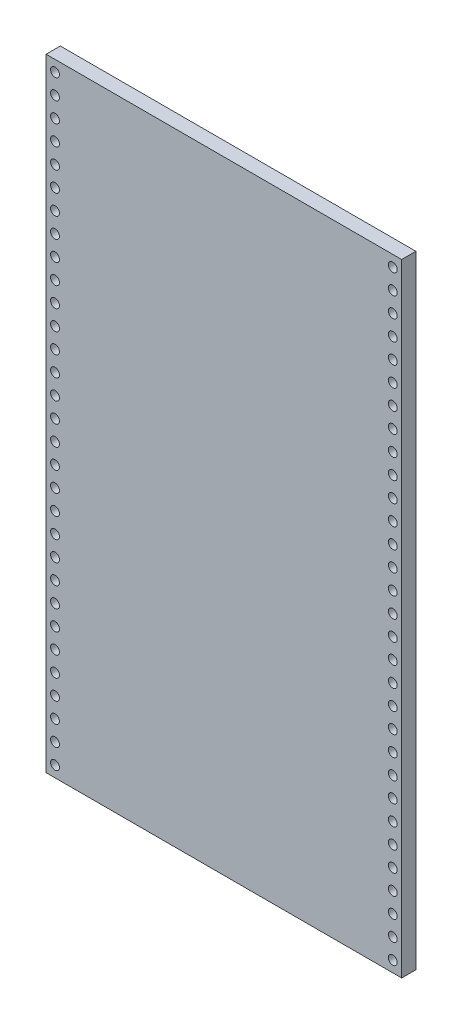
from build123d import *

# Parameters (mm, degrees)
SKETCH1_W                = 400
SKETCH1_H                = 700
BOSS_EXTRUDE1_DEPTH      = 16
SKETCH2_R                = 5
CUT_EXTRUDE1_DEPTH       = 729.186789224
LPATTERN1_COUNT          = 31
LPATTERN1_PITCH          = 22.5
MIRROR1_COPY_1_SKETCH_R  = 5
MIRROR1_COPY_1_DEPTH     = 729.186789224
MIRROR1_COPY_2_SKETCH_R  = 5
MIRROR1_COPY_2_DEPTH     = 729.186789224
MIRROR1_COPY_3_SKETCH_R  = 5
MIRROR1_COPY_3_DEPTH     = 729.186789224
MIRROR1_COPY_4_SKETCH_R  = 5
MIRROR1_COPY_4_DEPTH     = 729.186789224
MIRROR1_COPY_5_SKETCH_R  = 5
MIRROR1_COPY_5_DEPTH     = 729.186789224
MIRROR1_COPY_6_SKETCH_R  = 5
MIRROR1_COPY_6_DEPTH     = 729.186789224
MIRROR1_COPY_7_SKETCH_R  = 5
MIRROR1_COPY_7_DEPTH     = 729.186789224
MIRROR1_COPY_8_SKETCH_R  = 5
MIRROR1_COPY_8_DEPTH     = 729.186789224
MIRROR1_COPY_9_SKETCH_R  = 5
MIRROR1_COPY_9_DEPTH     = 729.186789224
MIRROR1_COPY_10_SKETCH_R = 5
MIRROR1_COPY_10_DEPTH    = 729.186789224
MIRROR1_COPY_11_SKETCH_R = 5
MIRROR1_COPY_11_DEPTH    = 729.186789224
MIRROR1_COPY_12_SKETCH_R = 5
MIRROR1_COPY_12_DEPTH    = 729.186789224
MIRROR1_COPY_13_SKETCH_R = 5
MIRROR1_COPY_13_DEPTH    = 729.186789224
MIRROR1_COPY_14_SKETCH_R = 5
MIRROR1_COPY_14_DEPTH    = 729.186789224
MIRROR1_COPY_15_SKETCH_R = 5
MIRROR1_COPY_15_DEPTH    = 729.186789224
MIRROR1_COPY_16_SKETCH_R = 5
MIRROR1_COPY_16_DEPTH    = 729.186789224
MIRROR1_COPY_17_SKETCH_R = 5
MIRROR1_COPY_17_DEPTH    = 729.186789224
MIRROR1_COPY_18_SKETCH_R = 5
MIRROR1_COPY_18_DEPTH    = 729.186789224
MIRROR1_COPY_19_SKETCH_R = 5
MIRROR1_COPY_19_DEPTH    = 729.186789224
MIRROR1_COPY_20_SKETCH_R = 5
MIRROR1_COPY_20_DEPTH    = 729.186789224
MIRROR1_COPY_21_SKETCH_R = 5
MIRROR1_COPY_21_DEPTH    = 729.186789224
MIRROR1_COPY_22_SKETCH_R = 5
MIRROR1_COPY_22_DEPTH    = 729.186789224
MIRROR1_COPY_23_SKETCH_R = 5
MIRROR1_COPY_23_DEPTH    = 729.186789224
MIRROR1_COPY_24_SKETCH_R = 5
MIRROR1_COPY_24_DEPTH    = 729.186789224
MIRROR1_COPY_25_SKETCH_R = 5
MIRROR1_COPY_25_DEPTH    = 729.186789224
MIRROR1_COPY_26_SKETCH_R = 5
MIRROR1_COPY_26_DEPTH    = 729.186789224
MIRROR1_COPY_27_SKETCH_R = 5
MIRROR1_COPY_27_DEPTH    = 729.186789224
MIRROR1_COPY_28_SKETCH_R = 5
MIRROR1_COPY_28_DEPTH    = 729.186789224
MIRROR1_COPY_29_SKETCH_R = 5
MIRROR1_COPY_29_DEPTH    = 729.186789224
MIRROR1_COPY_30_SKETCH_R = 5
MIRROR1_COPY_30_DEPTH    = 729.186789224


with BuildPart() as part:
    # Sketch1 → Boss-Extrude1 (new body)
    with BuildSketch(Plane.XY):
        with Locations((0, 350)):
            Rectangle(SKETCH1_W, SKETCH1_H)
    extrude(amount=BOSS_EXTRUDE1_DEPTH)

    # Sketch2 → Cut-Extrude1 (cut, symmetric)
    with BuildSketch(Plane.XY.offset(16)):
        with Locations(Location((190, 12.5, 0), (0, 0, 180))):
            Circle(SKETCH2_R)
    cut_extrude1 = extrude(amount=CUT_EXTRUDE1_DEPTH, both=True, mode=Mode.SUBTRACT)

    # LPattern1: Cut-Extrude1 ×31
    with Locations(*[(0, i * LPATTERN1_PITCH, 0) for i in range(1, LPATTERN1_COUNT)]):
        add(cut_extrude1, mode=Mode.SUBTRACT)

    # Mirror1: Cut-Extrude1 across plane
    add(cut_extrude1.mirror(Plane(origin=(0, 0, 0), x_dir=(0, 0, 1), z_dir=(1, 0, 0))), mode=Mode.SUBTRACT)

    # Mirror1 copy 1 sketch → Mirror1 copy 1 (cut, symmetric)
    with BuildSketch(Plane(origin=(0, 22.5, 16), x_dir=(-1, 0, 0), z_dir=(0, 0, 1))):
        with Locations((190, -12.5)):
            Circle(MIRROR1_COPY_1_SKETCH_R)
    extrude(amount=MIRROR1_COPY_1_DEPTH, both=True, mode=Mode.SUBTRACT)

    # Mirror1 copy 2 sketch → Mirror1 copy 2 (cut, symmetric)
    with BuildSketch(Plane(origin=(0, 45, 16), x_dir=(-1, 0, 0), z_dir=(0, 0, 1))):
        with Locations((190, -12.5)):
            Circle(MIRROR1_COPY_2_SKETCH_R)
    extrude(amount=MIRROR1_COPY_2_DEPTH, both=True, mode=Mode.SUBTRACT)

    # Mirror1 copy 3 sketch → Mirror1 copy 3 (cut, symmetric)
    with BuildSketch(Plane(origin=(0, 67.5, 16), x_dir=(-1, 0, 0), z_dir=(0, 0, 1))):
        with Locations((190, -12.5)):
            Circle(MIRROR1_COPY_3_SKETCH_R)
    extrude(amount=MIRROR1_COPY_3_DEPTH, both=True, mode=Mode.SUBTRACT)

    # Mirror1 copy 4 sketch → Mirror1 copy 4 (cut, symmetric)
    with BuildSketch(Plane(origin=(0, 90, 16), x_dir=(-1, 0, 0), z_dir=(0, 0, 1))):
        with Locations((190, -12.5)):
            Circle(MIRROR1_COPY_4_SKETCH_R)
    extrude(amount=MIRROR1_COPY_4_DEPTH, both=True, mode=Mode.SUBTRACT)

    # Mirror1 copy 5 sketch → Mirror1 copy 5 (cut, symmetric)
    with BuildSketch(Plane(origin=(0, 112.5, 16), x_dir=(-1, 0, 0), z_dir=(0, 0, 1))):
        with Locations((190, -12.5)):
            Circle(MIRROR1_COPY_5_SKETCH_R)
    extrude(amount=MIRROR1_COPY_5_DEPTH, both=True, mode=Mode.SUBTRACT)

    # Mirror1 copy 6 sketch → Mirror1 copy 6 (cut, symmetric)
    with BuildSketch(Plane(origin=(0, 135, 16), x_dir=(-1, 0, 0), z_dir=(0, 0, 1))):
        with Locations((190, -12.5)):
            Circle(MIRROR1_COPY_6_SKETCH_R)
    extrude(amount=MIRROR1_COPY_6_DEPTH, both=True, mode=Mode.SUBTRACT)

    # Mirror1 copy 7 sketch → Mirror1 copy 7 (cut, symmetric)
    with BuildSketch(Plane(origin=(0, 157.5, 16), x_dir=(-1, 0, 0), z_dir=(0, 0, 1))):
        with Locations((190, -12.5)):
            Circle(MIRROR1_COPY_7_SKETCH_R)
    extrude(amount=MIRROR1_COPY_7_DEPTH, both=True, mode=Mode.SUBTRACT)

    # Mirror1 copy 8 sketch → Mirror1 copy 8 (cut, symmetric)
    with BuildSketch(Plane(origin=(0, 180, 16), x_dir=(-1, 0, 0), z_dir=(0, 0, 1))):
        with Locations((190, -12.5)):
            Circle(MIRROR1_COPY_8_SKETCH_R)
    extrude(amount=MIRROR1_COPY_8_DEPTH, both=True, mode=Mode.SUBTRACT)

    # Mirror1 copy 9 sketch → Mirror1 copy 9 (cut, symmetric)
    with BuildSketch(Plane(origin=(0, 202.5, 16), x_dir=(-1, 0, 0), z_dir=(0, 0, 1))):
        with Locations((190, -12.5)):
            Circle(MIRROR1_COPY_9_SKETCH_R)
    extrude(amount=MIRROR1_COPY_9_DEPTH, both=True, mode=Mode.SUBTRACT)

    # Mirror1 copy 10 sketch → Mirror1 copy 10 (cut, symmetric)
    with BuildSketch(Plane(origin=(0, 225, 16), x_dir=(-1, 0, 0), z_dir=(0, 0, 1))):
        with Locations((190, -12.5)):
            Circle(MIRROR1_COPY_10_SKETCH_R)
    extrude(amount=MIRROR1_COPY_10_DEPTH, both=True, mode=Mode.SUBTRACT)

    # Mirror1 copy 11 sketch → Mirror1 copy 11 (cut, symmetric)
    with BuildSketch(Plane(origin=(0, 247.5, 16), x_dir=(-1, 0, 0), z_dir=(0, 0, 1))):
        with Locations((190, -12.5)):
            Circle(MIRROR1_COPY_11_SKETCH_R)
    extrude(amount=MIRROR1_COPY_11_DEPTH, both=True, mode=Mode.SUBTRACT)

    # Mirror1 copy 12 sketch → Mirror1 copy 12 (cut, symmetric)
    with BuildSketch(Plane(origin=(0, 270, 16), x_dir=(-1, 0, 0), z_dir=(0, 0, 1))):
        with Locations((190, -12.5)):
            Circle(MIRROR1_COPY_12_SKETCH_R)
    extrude(amount=MIRROR1_COPY_12_DEPTH, both=True, mode=Mode.SUBTRACT)

    # Mirror1 copy 13 sketch → Mirror1 copy 13 (cut, symmetric)
    with BuildSketch(Plane(origin=(0, 292.5, 16), x_dir=(-1, 0, 0), z_dir=(0, 0, 1))):
        with Locations((190, -12.5)):
            Circle(MIRROR1_COPY_13_SKETCH_R)
    extrude(amount=MIRROR1_COPY_13_DEPTH, both=True, mode=Mode.SUBTRACT)

    # Mirror1 copy 14 sketch → Mirror1 copy 14 (cut, symmetric)
    with BuildSketch(Plane(origin=(0, 315, 16), x_dir=(-1, 0, 0), z_dir=(0, 0, 1))):
        with Locations((190, -12.5)):
            Circle(MIRROR1_COPY_14_SKETCH_R)
    extrude(amount=MIRROR1_COPY_14_DEPTH, both=True, mode=Mode.SUBTRACT)

    # Mirror1 copy 15 sketch → Mirror1 copy 15 (cut, symmetric)
    with BuildSketch(Plane(origin=(0, 337.5, 16), x_dir=(-1, 0, 0), z_dir=(0, 0, 1))):
        with Locations((190, -12.5)):
            Circle(MIRROR1_COPY_15_SKETCH_R)
    extrude(amount=MIRROR1_COPY_15_DEPTH, both=True, mode=Mode.SUBTRACT)

    # Mirror1 copy 16 sketch → Mirror1 copy 16 (cut, symmetric)
    with BuildSketch(Plane(origin=(0, 360, 16), x_dir=(-1, 0, 0), z_dir=(0, 0, 1))):
        with Locations((190, -12.5)):
            Circle(MIRROR1_COPY_16_SKETCH_R)
    extrude(amount=MIRROR1_COPY_16_DEPTH, both=True, mode=Mode.SUBTRACT)

    # Mirror1 copy 17 sketch → Mirror1 copy 17 (cut, symmetric)
    with BuildSketch(Plane(origin=(0, 382.5, 16), x_dir=(-1, 0, 0), z_dir=(0, 0, 1))):
        with Locations((190, -12.5)):
            Circle(MIRROR1_COPY_17_SKETCH_R)
    extrude(amount=MIRROR1_COPY_17_DEPTH, both=True, mode=Mode.SUBTRACT)

    # Mirror1 copy 18 sketch → Mirror1 copy 18 (cut, symmetric)
    with BuildSketch(Plane(origin=(0, 405, 16), x_dir=(-1, 0, 0), z_dir=(0, 0, 1))):
        with Locations((190, -12.5)):
            Circle(MIRROR1_COPY_18_SKETCH_R)
    extrude(amount=MIRROR1_COPY_18_DEPTH, both=True, mode=Mode.SUBTRACT)

    # Mirror1 copy 19 sketch → Mirror1 copy 19 (cut, symmetric)
    with BuildSketch(Plane(origin=(0, 427.5, 16), x_dir=(-1, 0, 0), z_dir=(0, 0, 1))):
        with Locations((190, -12.5)):
            Circle(MIRROR1_COPY_19_SKETCH_R)
    extrude(amount=MIRROR1_COPY_19_DEPTH, both=True, mode=Mode.SUBTRACT)

    # Mirror1 copy 20 sketch → Mirror1 copy 20 (cut, symmetric)
    with BuildSketch(Plane(origin=(0, 450, 16), x_dir=(-1, 0, 0), z_dir=(0, 0, 1))):
        with Locations((190, -12.5)):
            Circle(MIRROR1_COPY_20_SKETCH_R)
    extrude(amount=MIRROR1_COPY_20_DEPTH, both=True, mode=Mode.SUBTRACT)

    # Mirror1 copy 21 sketch → Mirror1 copy 21 (cut, symmetric)
    with BuildSketch(Plane(origin=(0, 472.5, 16), x_dir=(-1, 0, 0), z_dir=(0, 0, 1))):
        with Locations((190, -12.5)):
            Circle(MIRROR1_COPY_21_SKETCH_R)
    extrude(amount=MIRROR1_COPY_21_DEPTH, both=True, mode=Mode.SUBTRACT)

    # Mirror1 copy 22 sketch → Mirror1 copy 22 (cut, symmetric)
    with BuildSketch(Plane(origin=(0, 495, 16), x_dir=(-1, 0, 0), z_dir=(0, 0, 1))):
        with Locations((190, -12.5)):
            Circle(MIRROR1_COPY_22_SKETCH_R)
    extrude(amount=MIRROR1_COPY_22_DEPTH, both=True, mode=Mode.SUBTRACT)

    # Mirror1 copy 23 sketch → Mirror1 copy 23 (cut, symmetric)
    with BuildSketch(Plane(origin=(0, 517.5, 16), x_dir=(-1, 0, 0), z_dir=(0, 0, 1))):
        with Locations((190, -12.5)):
            Circle(MIRROR1_COPY_23_SKETCH_R)
    extrude(amount=MIRROR1_COPY_23_DEPTH, both=True, mode=Mode.SUBTRACT)

    # Mirror1 copy 24 sketch → Mirror1 copy 24 (cut, symmetric)
    with BuildSketch(Plane(origin=(0, 540, 16), x_dir=(-1, 0, 0), z_dir=(0, 0, 1))):
        with Locations((190, -12.5)):
            Circle(MIRROR1_COPY_24_SKETCH_R)
    extrude(amount=MIRROR1_COPY_24_DEPTH, both=True, mode=Mode.SUBTRACT)

    # Mirror1 copy 25 sketch → Mirror1 copy 25 (cut, symmetric)
    with BuildSketch(Plane(origin=(0, 562.5, 16), x_dir=(-1, 0, 0), z_dir=(0, 0, 1))):
        with Locations((190, -12.5)):
            Circle(MIRROR1_COPY_25_SKETCH_R)
    extrude(amount=MIRROR1_COPY_25_DEPTH, both=True, mode=Mode.SUBTRACT)

    # Mirror1 copy 26 sketch → Mirror1 copy 26 (cut, symmetric)
    with BuildSketch(Plane(origin=(0, 585, 16), x_dir=(-1, 0, 0), z_dir=(0, 0, 1))):
        with Locations((190, -12.5)):
            Circle(MIRROR1_COPY_26_SKETCH_R)
    extrude(amount=MIRROR1_COPY_26_DEPTH, both=True, mode=Mode.SUBTRACT)

    # Mirror1 copy 27 sketch → Mirror1 copy 27 (cut, symmetric)
    with BuildSketch(Plane(origin=(0, 607.5, 16), x_dir=(-1, 0, 0), z_dir=(0, 0, 1))):
        with Locations((190, -12.5)):
            Circle(MIRROR1_COPY_27_SKETCH_R)
    extrude(amount=MIRROR1_COPY_27_DEPTH, both=True, mode=Mode.SUBTRACT)

    # Mirror1 copy 28 sketch → Mirror1 copy 28 (cut, symmetric)
    with BuildSketch(Plane(origin=(0, 630, 16), x_dir=(-1, 0, 0), z_dir=(0, 0, 1))):
        with Locations((190, -12.5)):
            Circle(MIRROR1_COPY_28_SKETCH_R)
    extrude(amount=MIRROR1_COPY_28_DEPTH, both=True, mode=Mode.SUBTRACT)

    # Mirror1 copy 29 sketch → Mirror1 copy 29 (cut, symmetric)
    with BuildSketch(Plane(origin=(0, 652.5, 16), x_dir=(-1, 0, 0), z_dir=(0, 0, 1))):
        with Locations((190, -12.5)):
            Circle(MIRROR1_COPY_29_SKETCH_R)
    extrude(amount=MIRROR1_COPY_29_DEPTH, both=True, mode=Mode.SUBTRACT)

    # Mirror1 copy 30 sketch → Mirror1 copy 30 (cut, symmetric)
    with BuildSketch(Plane(origin=(0, 675, 16), x_dir=(-1, 0, 0), z_dir=(0, 0, 1))):
        with Locations((190, -12.5)):
            Circle(MIRROR1_COPY_30_SKETCH_R)
    extrude(amount=MIRROR1_COPY_30_DEPTH, both=True, mode=Mode.SUBTRACT)


solid = part.part
